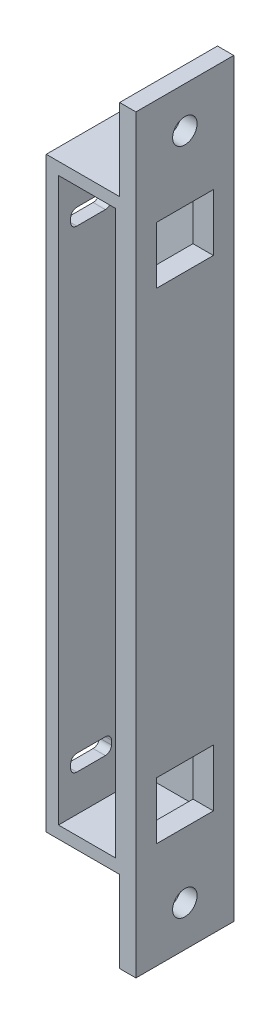
from build123d import *

# Parameters (mm, degrees)
SKETCH1_W           = 11
SKETCH1_H           = 72
BOSS_EXTRUDE1_DEPTH = 12
SKETCH2_W           = 12
SKETCH2_H           = 10
SKETCH2_R           = 1.5
BOSS_EXTRUDE2_DEPTH = 2
SKETCH3_W           = 7
SKETCH3_H           = 7
CUT_EXTRUDE1_DEPTH  = 3
SKETCH4_W           = 7
SKETCH4_H           = 69
CUT_EXTRUDE2_DEPTH  = 10.5
CUT_EXTRUDE3_DEPTH  = 1.5


with BuildPart() as part:
    # Sketch1 → Boss-Extrude1 (new body)
    with BuildSketch(Plane.XY):
        with Locations((5.5, 36)):
            Rectangle(SKETCH1_W, SKETCH1_H)
    extrude(amount=BOSS_EXTRUDE1_DEPTH)

    # Sketch2 → Boss-Extrude2 (add)
    # profile 1 of 2: a face of its own
    with BuildSketch(Plane(origin=(11, 0, 0), x_dir=(0, 0, -1), z_dir=(1, 0, 0))):
        with Locations((-6, 77)):
            Rectangle(SKETCH2_W, SKETCH2_H)
        with Locations((-6, 77)):
            Circle(SKETCH2_R, mode=Mode.SUBTRACT)
    # profile 2 of 2: a face of its own
    with BuildSketch(Plane(origin=(11, 0, 0), x_dir=(0, 0, -1), z_dir=(1, 0, 0))):
        with Locations((-6, -5)):
            Rectangle(SKETCH2_W, SKETCH2_H)
        with Locations(Location((-6, -5, 0), (0, 0, 180))):
            Circle(SKETCH2_R, mode=Mode.SUBTRACT)
    extrude(amount=-BOSS_EXTRUDE2_DEPTH)

    # Sketch3 → Cut-Extrude1 (cut)
    with BuildSketch(Plane(origin=(11, 0, 0), x_dir=(0, 0, -1), z_dir=(1, 0, 0))):
        with Locations((-6, 65.5)):
            Rectangle(SKETCH3_W, SKETCH3_H)
        with Locations((-6, 6.5)):
            Rectangle(SKETCH3_W, SKETCH3_H)
    extrude(amount=-CUT_EXTRUDE1_DEPTH, mode=Mode.SUBTRACT)

    # Sketch4 → Cut-Extrude2 (cut)
    with BuildSketch(Plane.XY.offset(12)):
        with Locations((5, 36)):
            Rectangle(SKETCH4_W, SKETCH4_H)
    extrude(amount=-CUT_EXTRUDE2_DEPTH, mode=Mode.SUBTRACT)

    # Sketch5 → Cut-Extrude3 (cut)
    with BuildSketch(Plane.ZY):
        with BuildLine():
            Line((6.25, 66), (9.75, 66))
            ThreePointArc((9.75, 66), (10.280330086, 65.780330086), (10.5, 65.25))
            Line((10.5, 65.25), (10.5, 64.75))
            ThreePointArc((10.5, 64.75), (10.280330086, 64.219669914), (9.75, 64))
            Line((9.75, 64), (6.25, 64))
            ThreePointArc((6.25, 64), (5.719669914, 64.219669914), (5.5, 64.75))
            Line((5.5, 64.75), (5.5, 65.25))
            ThreePointArc((5.5, 65.25), (5.719669914, 65.780330086), (6.25, 66))
        make_face()
        with BuildLine():
            Line((6.25, 8), (9.75, 8))
            ThreePointArc((9.75, 8), (10.280330086, 7.780330086), (10.5, 7.25))
            Line((10.5, 7.25), (10.5, 6.75))
            ThreePointArc((10.5, 6.75), (10.280330086, 6.219669914), (9.75, 6))
            Line((9.75, 6), (6.25, 6))
            ThreePointArc((6.25, 6), (5.719669914, 6.219669914), (5.5, 6.75))
            Line((5.5, 6.75), (5.5, 7.25))
            ThreePointArc((5.5, 7.25), (5.719669914, 7.780330086), (6.25, 8))
        make_face()
    extrude(amount=-CUT_EXTRUDE3_DEPTH, mode=Mode.SUBTRACT)


solid = part.part
